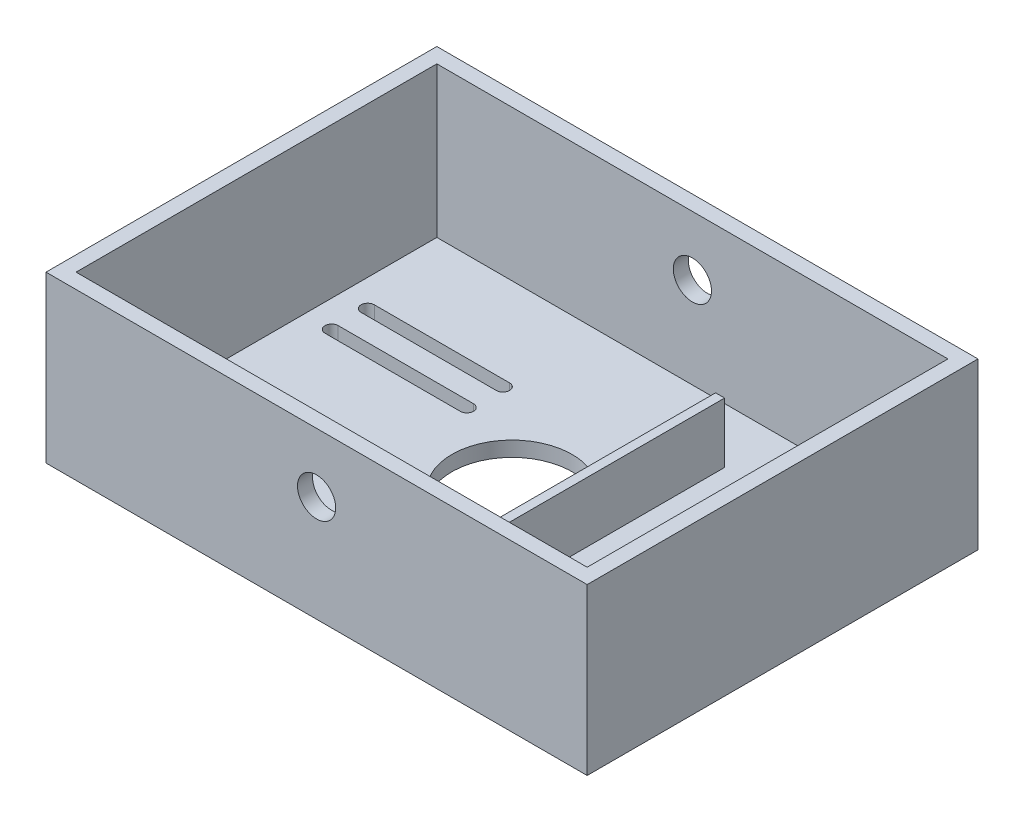
from build123d import *

# Parameters (mm, degrees)
ESQUISSE1_W             = 180
ESQUISSE1_H             = 130
ESQUISSE1_W_2           = 170
ESQUISSE1_H_2           = 120
BOSS_EXTRU_2_DEPTH      = 55
ESQUISSE2_W             = 170
ESQUISSE2_H             = 120
BOSS_EXTRU_3_DEPTH      = 5
ESQUISSE3_R             = 20
ENL_V_MAT_EXTRU_1_DEPTH = 122.757956619
ENL_V_MAT_EXTRU_2_DEPTH = 122.757956619
ENL_V_MAT_EXTRU_3_REACH = 169.407
ESQUISSE5_R             = 6.35
ESQUISSE6_W             = 3
ESQUISSE6_H             = 101.6
BOSS_EXTRU_4_DEPTH      = 20


with BuildPart() as part:
    # Esquisse1 → Boss.-Extru.2 (new body)
    with BuildSketch(Plane(origin=(0, 0, 0), x_dir=(1, 0, 0), z_dir=(0, 1, 0))):
        Rectangle(ESQUISSE1_W, ESQUISSE1_H)
        Rectangle(ESQUISSE1_W_2, ESQUISSE1_H_2, mode=Mode.SUBTRACT)
    extrude(amount=BOSS_EXTRU_2_DEPTH)

    # Esquisse2 → Boss.-Extru.3 (add)
    with BuildSketch(Plane(origin=(0, 0, 0), x_dir=(1, 0, 0), z_dir=(0, 1, 0))):
        Rectangle(ESQUISSE2_W, ESQUISSE2_H)
    extrude(amount=BOSS_EXTRU_3_DEPTH)

    # Esquisse3 → Enlèv. mat.-Extru.1 (cut, through all)
    with BuildSketch(Plane(origin=(0, 5, 0), x_dir=(1, 0, 0), z_dir=(0, 1, 0))):
        with Locations(Location((0, 0, 0), (0, 0, 270))):
            Circle(ESQUISSE3_R)
    extrude(amount=-ENL_V_MAT_EXTRU_1_DEPTH, mode=Mode.SUBTRACT)

    # Esquisse4 → Enlèv. mat.-Extru.2 (cut, through all)
    with BuildSketch(Plane(origin=(0, 5, 0), x_dir=(1, 0, 0), z_dir=(0, 1, 0))):
        with BuildLine():
            Line((-76, 30.2), (-31, 30.2))
            ThreePointArc((-31, 30.2), (-28.8, 28), (-31, 25.8))
            Line((-31, 25.8), (-76, 25.8))
            ThreePointArc((-76, 25.8), (-78.2, 28), (-76, 30.2))
        make_face()
        with BuildLine():
            Line((-76, 18.2), (-31, 18.2))
            ThreePointArc((-31, 18.2), (-28.8, 16), (-31, 13.8))
            Line((-31, 13.8), (-76, 13.8))
            ThreePointArc((-76, 13.8), (-78.2, 16), (-76, 18.2))
        make_face()
    extrude(amount=-ENL_V_MAT_EXTRU_2_DEPTH, mode=Mode.SUBTRACT)

    # Enlèv. mat.-Extru.3: up to this face of the body (flat: up to its plane)
    enl_v_mat_extru_3_end = Plane(part.part.faces().sort_by_distance((0, 27.5, 65))[0])
    # Esquisse5 → Enlèv. mat.-Extru.3 (cut, up to the picked face)
    with BuildSketch(Plane(origin=(0, 0, -65), x_dir=(-1, 0, 0), z_dir=(0, 0, -1)), mode=Mode.PRIVATE) as enl_v_mat_extru_3_sk1:
        with Locations((0, 35.25)):
            Circle(ESQUISSE5_R)
    enl_v_mat_extru_3_tool1 = split(extrude(enl_v_mat_extru_3_sk1.sketch, amount=-ENL_V_MAT_EXTRU_3_REACH, mode=Mode.PRIVATE), bisect_by=enl_v_mat_extru_3_end, keep=Keep.BOTH, mode=Mode.PRIVATE)
    add(enl_v_mat_extru_3_tool1.solids().sort_by(Axis((0, 35.25, -65), (0, 0, 1)))[0], mode=Mode.SUBTRACT)

    # Esquisse6 → Boss.-Extru.4 (add)
    with BuildSketch(Plane(origin=(0, 5, 0), x_dir=(1, 0, 0), z_dir=(0, 1, 0))):
        with Locations((27.62, -9.2)):
            Rectangle(ESQUISSE6_W, ESQUISSE6_H)
    extrude(amount=BOSS_EXTRU_4_DEPTH)


solid = part.part
